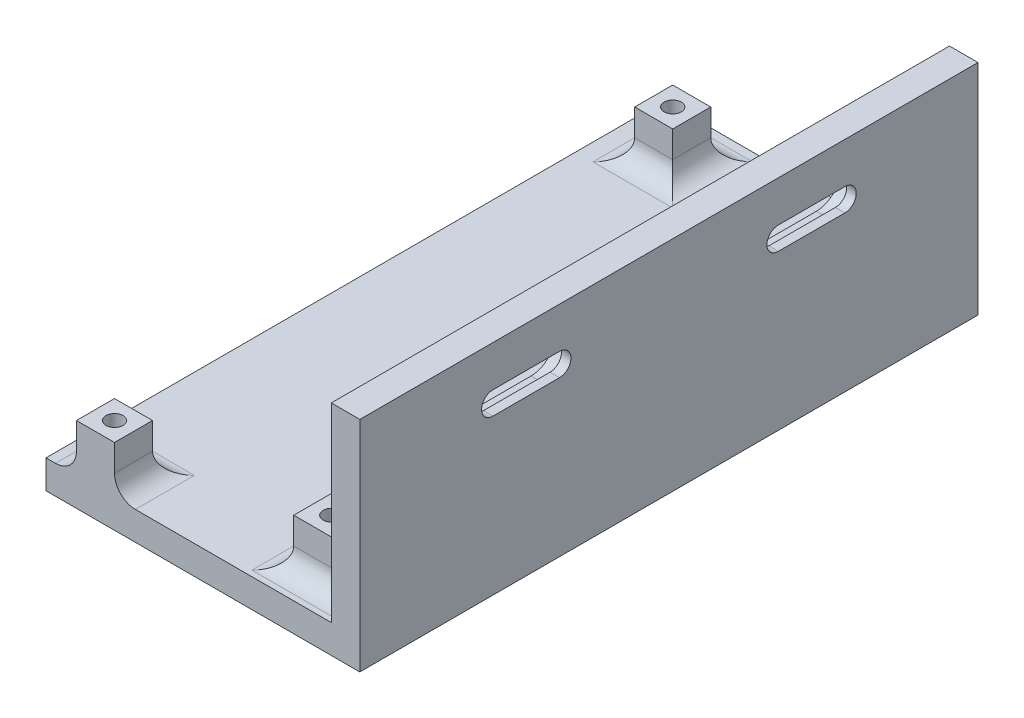
from build123d import *

# Parameters (mm, degrees)
BOSS_EXTRUDE1_DEPTH = 65
SKETCH2_W           = 4
SKETCH2_H           = 4
SKETCH2_R           = 0.9
BOSS_EXTRUDE2_DEPTH = 5
CUT_EXTRUDE2_REACH  = 81.612
SKETCH3_W           = 16.5
SKETCH3_H           = 10.5
CUT_EXTRUDE3_REACH  = 82.864
CUT_EXTRUDE4_DEPTH  = 2
FILLET1_R           = 2.2
CUT_EXTRUDE5_REACH  = 81.687
SKETCH7_W           = 65
SKETCH7_H           = 12


with BuildPart() as part:
    # Sketch1 → Boss-Extrude1 (new body)
    with BuildSketch(Plane.XY):
        Polygon((0, 0), (33, 0), (33, 35), (30, 35), (30, 3), (0, 3), align=None)
    extrude(amount=BOSS_EXTRUDE1_DEPTH)

    # Sketch2 → Boss-Extrude2 (add)
    # profile 1 of 4: a face of its own
    with BuildSketch(Plane(origin=(0, 3, 0), x_dir=(1, 0, 0), z_dir=(0, 1, 0))):
        with Locations((25.25, -60.2)):
            Rectangle(SKETCH2_W, SKETCH2_H)
        with Locations(Location((25.25, -60.2, 0), (0, 0, 270))):
            Circle(SKETCH2_R, mode=Mode.SUBTRACT)
    # profile 2 of 4: a face of its own
    with BuildSketch(Plane(origin=(0, 3, 0), x_dir=(1, 0, 0), z_dir=(0, 1, 0))):
        with Locations((25.25, -4.8)):
            Rectangle(SKETCH2_W, SKETCH2_H)
        with Locations((25.25, -4.8)):
            Circle(SKETCH2_R, mode=Mode.SUBTRACT)
    # profile 3 of 4: a face of its own
    with BuildSketch(Plane(origin=(0, 3, 0), x_dir=(1, 0, 0), z_dir=(0, 1, 0))):
        with Locations((6, -5.1)):
            Rectangle(SKETCH2_W, SKETCH2_H)
        with Locations(Location((6, -5.1, 0), (0, 0, 270))):
            Circle(SKETCH2_R, mode=Mode.SUBTRACT)
    # profile 4 of 4: a face of its own
    with BuildSketch(Plane(origin=(0, 3, 0), x_dir=(1, 0, 0), z_dir=(0, 1, 0))):
        with Locations((5.2, -63)):
            Rectangle(SKETCH2_W, SKETCH2_H)
        with Locations(Location((5.2, -63, 0), (0, 0, 270))):
            Circle(SKETCH2_R, mode=Mode.SUBTRACT)
    extrude(amount=BOSS_EXTRUDE2_DEPTH)

    # Sketch3 → Cut-Extrude2 (cut, up to next)
    with BuildSketch(Plane(origin=(0, 3, 0), x_dir=(1, 0, 0), z_dir=(0, 1, 0)), mode=Mode.PRIVATE) as cut_extrude2_sk1:
        with Locations((21.75, -17.622736475)):
            Rectangle(SKETCH3_W, SKETCH3_H)
    cut_extrude2_tool1 = extrude(cut_extrude2_sk1.sketch, amount=-CUT_EXTRUDE2_REACH, mode=Mode.PRIVATE) & part.part
    add(cut_extrude2_tool1.solids().sort_by_distance((21.75, 3, 17.622736))[0], mode=Mode.SUBTRACT)

    # Sketch4 → Cut-Extrude3 (cut, up to next)
    with BuildSketch(Plane(origin=(33, 0, 0), x_dir=(0, 0, -1), z_dir=(1, 0, 0)), mode=Mode.PRIVATE) as cut_extrude3_sk1:
        with BuildLine():
            Line((-44.00188963, 16.3), (-50.99811037, 16.3))
            ThreePointArc((-50.99811037, 16.3), (-52.19811037, 17.5), (-50.99811037, 18.7))
            Line((-50.99811037, 18.7), (-44.00188963, 18.7))
            ThreePointArc((-44.00188963, 18.7), (-42.80188963, 17.5), (-44.00188963, 16.3))
        make_face()
    cut_extrude3_tool1 = extrude(cut_extrude3_sk1.sketch, amount=-CUT_EXTRUDE3_REACH, mode=Mode.PRIVATE) & part.part
    # Sketch4 → Cut-Extrude3 (cut, up to next)
    with BuildSketch(Plane(origin=(33, 0, 0), x_dir=(0, 0, -1), z_dir=(1, 0, 0)), mode=Mode.PRIVATE) as cut_extrude3_sk2:
        with BuildLine():
            Line((-20.99811037, 16.3), (-14.00188963, 16.3))
            ThreePointArc((-14.00188963, 16.3), (-12.80188963, 17.5), (-14.00188963, 18.7))
            Line((-14.00188963, 18.7), (-20.99811037, 18.7))
            ThreePointArc((-20.99811037, 18.7), (-22.19811037, 17.5), (-20.99811037, 16.3))
        make_face()
    cut_extrude3_tool2 = extrude(cut_extrude3_sk2.sketch, amount=-CUT_EXTRUDE3_REACH, mode=Mode.PRIVATE) & part.part
    add(cut_extrude3_tool1.solids().sort_by_distance((33, 17.5, 47.5))[0], mode=Mode.SUBTRACT)
    add(cut_extrude3_tool2.solids().sort_by_distance((33, 17.5, 17.5))[0], mode=Mode.SUBTRACT)

    # Sketch5 → Cut-Extrude4 (cut)
    with BuildSketch(Plane.ZY.offset(-30)):
        with BuildLine():
            Line((20.99811037, 14.95), (14.00188963, 14.95))
            ThreePointArc((14.00188963, 14.95), (11.45188963, 17.5), (14.00188963, 20.05))
            Line((14.00188963, 20.05), (20.99811037, 20.05))
            ThreePointArc((20.99811037, 20.05), (23.54811037, 17.5), (20.99811037, 14.95))
        make_face()
        with BuildLine():
            Line((44.00188963, 20.05), (50.99811037, 20.05))
            ThreePointArc((50.99811037, 20.05), (53.54811037, 17.5), (50.99811037, 14.95))
            Line((50.99811037, 14.95), (44.00188963, 14.95))
            ThreePointArc((44.00188963, 14.95), (41.45188963, 17.5), (44.00188963, 20.05))
        make_face()
    extrude(amount=-CUT_EXTRUDE4_DEPTH, mode=Mode.SUBTRACT)

    # Fillet1
    fillet1_edges = [part.edges().sort_by_distance(p)[0] for p in [
        (25.25, 3, 58.2),
        (27.25, 3, 60.2),
        (25.25, 3, 62.2),
        (23.25, 3, 60.2),
        (25.25, 3, 2.8),
        (23.25, 3, 4.8),
        (27.25, 3, 4.8),
        (25.25, 3, 6.8),
        (7.2, 3, 63),
        (5.2, 3, 61),
        (3.2, 3, 63),
        (8, 3, 5.1),
        (6, 3, 3.1),
        (6, 3, 7.1),
        (4, 3, 5.1),
    ]]
    fillet(fillet1_edges, radius=FILLET1_R)

    # Sketch7 → Cut-Extrude5 (cut, up to next)
    with BuildSketch(Plane.ZY.offset(-30), mode=Mode.PRIVATE) as cut_extrude5_sk1:
        with Locations((32.5, 29)):
            Rectangle(SKETCH7_W, SKETCH7_H)
    cut_extrude5_tool1 = extrude(cut_extrude5_sk1.sketch, amount=-CUT_EXTRUDE5_REACH, mode=Mode.PRIVATE) & part.part
    add(cut_extrude5_tool1.solids().sort_by_distance((30, 29, 32.5))[0], mode=Mode.SUBTRACT)


solid = part.part
